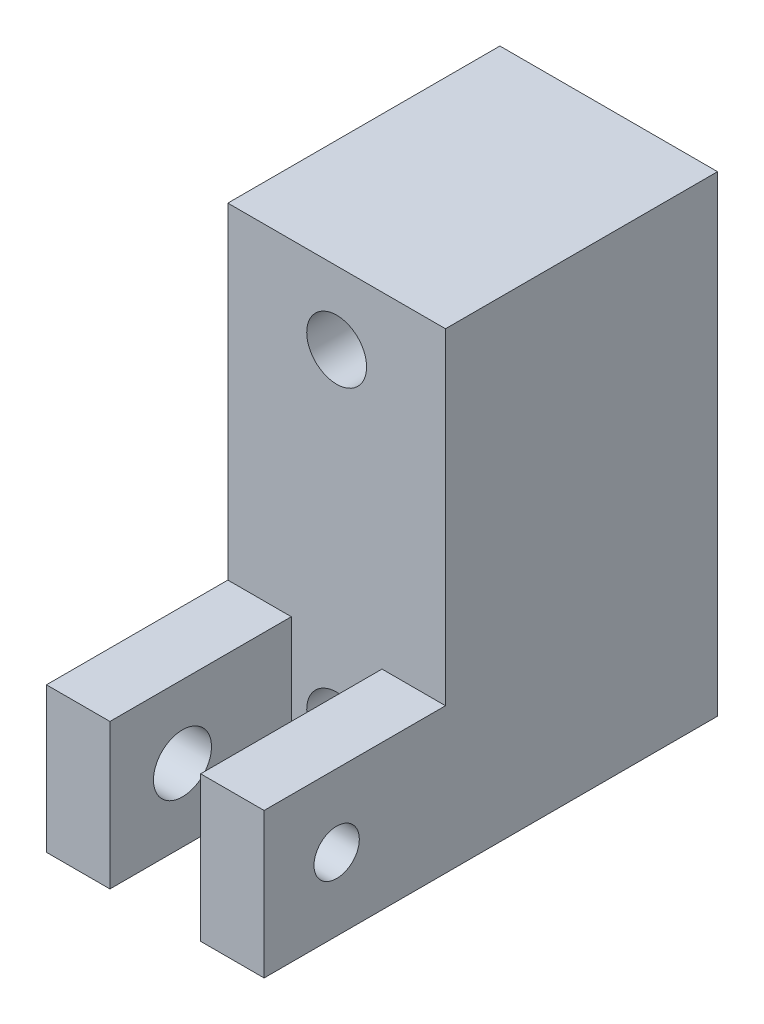
from build123d import *

# Parameters (mm, degrees)
EXTRUDE_1_DEPTH          = 6
CUT_EXTRUDE_1_REACH      = 27.812
SKETCH_2_W               = 5
SKETCH_2_H               = 10
HOLE_WIZARD_M3_1_D       = 2.5
HOLE_WIZARD_M3_1_DEPTH   = 3.5
HOLE_WIZARD_M3_1_2_D     = 3.2
HOLE_WIZARD_M3_1_2_DEPTH = 3.5
HOLE_WIZARD_M4_2_D       = 3.3
HOLE_WIZARD_M4_1_D       = 3.3


with BuildPart() as part:
    # 草图1 → 凸台-拉伸1 (new, symmetric)
    with BuildSketch(Plane(origin=(0, 0, 0), x_dir=(0, 0, -1), z_dir=(1, 0, 0))):
        Polygon((-7.5, -13), (7.5, -13), (7.5, 13), (-7.5, 13), (-7.5, -5), (-17.5, -5), (-17.5, -13), align=None)
    extrude(amount=EXTRUDE_1_DEPTH, both=True)

    # 草图2 → 切除-拉伸1 (cut, up to next)
    with BuildSketch(Plane(origin=(0, -5, 0), x_dir=(1, 0, 0), z_dir=(0, 1, 0)), mode=Mode.PRIVATE) as cut_extrude_1_sk1:
        with Locations((0, -12.5)):
            Rectangle(SKETCH_2_W, SKETCH_2_H)
    cut_extrude_1_tool1 = extrude(cut_extrude_1_sk1.sketch, amount=-CUT_EXTRUDE_1_REACH, mode=Mode.PRIVATE) & part.part
    add(cut_extrude_1_tool1.solids().sort_by_distance((0, -5, 12.5))[0], mode=Mode.SUBTRACT)

    # Hole Wizard M3 _1
    with Locations(Plane(origin=(6, 0, 0), x_dir=(0, 0, -1), z_dir=(1, 0, 0))):
        with Locations((-13.5, -9)):
            Hole(HOLE_WIZARD_M3_1_D / 2, depth=HOLE_WIZARD_M3_1_DEPTH)

    # Hole Wizard M3 _1 2
    with Locations(Plane.ZY.offset(6)):
        with Locations((13.5, -9)):
            Hole(HOLE_WIZARD_M3_1_2_D / 2, depth=HOLE_WIZARD_M3_1_2_DEPTH)

    # M4 螺纹孔2 (through all)
    with Locations(Plane(origin=(0, 0, -7.5), x_dir=(-1, 0, 0), z_dir=(0, 0, -1))):
        with Locations((0, -9)):
            Hole(HOLE_WIZARD_M4_2_D / 2)

    # M4 螺纹孔1 (through all)
    with Locations(Plane(origin=(0, 0, -7.5), x_dir=(-1, 0, 0), z_dir=(0, 0, -1))):
        with Locations((0, 9)):
            Hole(HOLE_WIZARD_M4_1_D / 2)


solid = part.part
